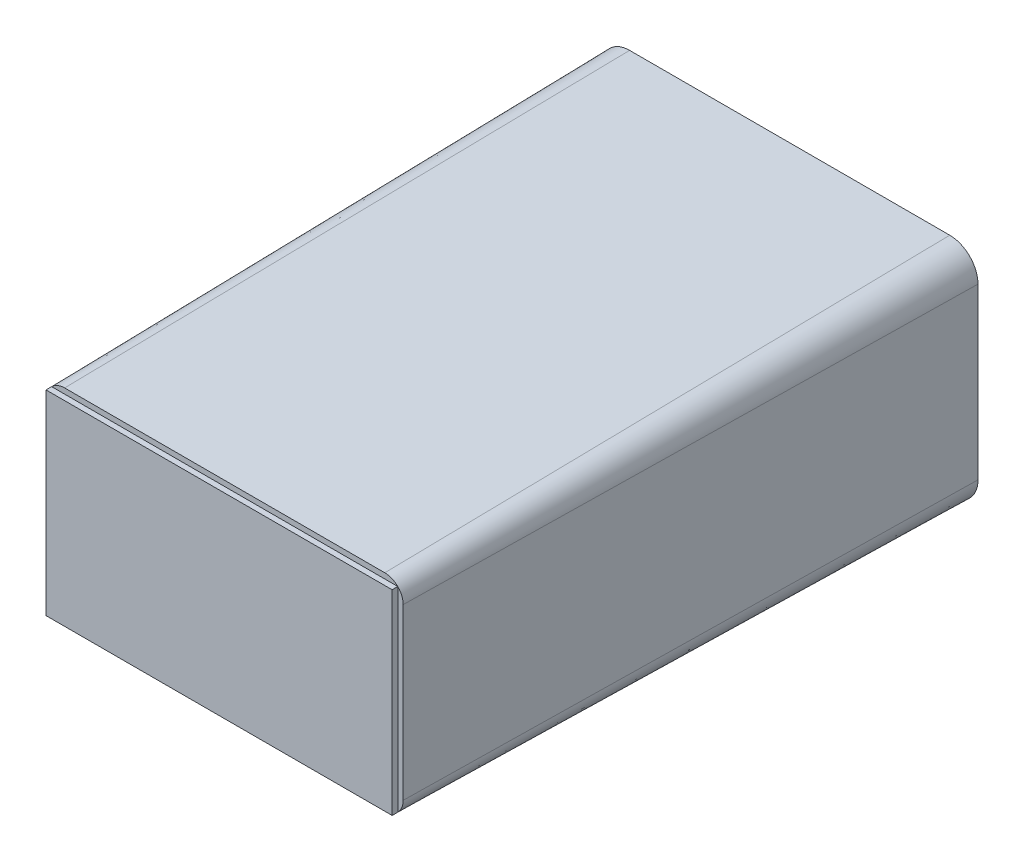
from build123d import *

# Parameters (mm, degrees)
EXTRUDE_1_DEPTH  = 300
EXTRUDE_1_TAPER  = 1
SHELL_1_T        = -4
EXTRUDE_2_DEPTH  = 60
SKETCH_5_W       = 90.762871209
SKETCH_5_H       = 50.762871209
EXTRUDE_3_DEPTH  = 3
EXTRUDE_4_DEPTH  = 3
SKETCH_8_W       = 183.80764657
SKETCH_8_H       = 103.80764657
EXTRUDE_11_DEPTH = 3


with BuildPart() as part:
    # 草图1 → 凸台-拉伸1 (new body)
    with BuildSketch(Plane.XY):
        with BuildLine():
            ThreePointArc((-85, 60), (-95.606601718, 55.606601718), (-100, 45))
            Line((-100, 45), (-100, -45))
            ThreePointArc((-100, -45), (-95.606601718, -55.606601718), (-85, -60))
            Line((-85, -60), (85, -60))
            ThreePointArc((85, -60), (95.606601718, -55.606601718), (100, -45))
            Line((100, -45), (100, 45))
            ThreePointArc((100, 45), (95.606601718, 55.606601718), (85, 60))
            Line((85, 60), (-85, 60))
        make_face()
    extrude(amount=EXTRUDE_1_DEPTH, taper=EXTRUDE_1_TAPER)

    # 抽壳1
    shell_1_openings = [part.faces().sort_by_distance(p)[0] for p in [
        (0, 0, 300),
    ]]
    offset(amount=SHELL_1_T, openings=shell_1_openings, kind=Kind.INTERSECTION)

    # 草图4 → 凸台-拉伸2 (add)
    with BuildSketch(Plane.XY.offset(4)):
        Polygon((0, 0.466595392), (0, 0), (0, -0.395363651), (2.934231711, -0.395363651), (2.934231711, 0), (2.934231711, 50.762871209), (0, 50.762871209), align=None)
    extrude_2 = extrude(amount=EXTRUDE_2_DEPTH)

    # 草图5 → 凸台-拉伸3 (add)
    with BuildSketch(Plane(origin=(6.01372394, 0, 64), x_dir=(1, 0, 0), z_dir=(0, 0, 1))):
        with Locations((45.381435605, 25.381435605)):
            Rectangle(SKETCH_5_W, SKETCH_5_H)
    extrude_3 = extrude(amount=EXTRUDE_3_DEPTH)

    # 草图6 → 凸台-拉伸4 (add)
    with BuildSketch(Plane.XY.offset(64)):
        Polygon((0, 25.183753779), (6.01372394, 28.76636796), (6.01372394, 21.601139598), align=None)
    extrude(amount=EXTRUDE_4_DEPTH)

    # 镜向1: 凸台-拉伸2, 凸台-拉伸3 across plane
    add(extrude_2.mirror(Plane(origin=(0, -0.395363651, 64), x_dir=(0, 0, 1), z_dir=(0, -1, 0))))
    add(extrude_3.mirror(Plane(origin=(0, -0.395363651, 64), x_dir=(0, 0, 1), z_dir=(0, -1, 0))))

    # 草图8 → 凸台-拉伸11 (add)
    with BuildSketch(Plane.XY.offset(300)):
        Rectangle(SKETCH_8_W, SKETCH_8_H)
    extrude(amount=EXTRUDE_11_DEPTH)


solid = part.part
